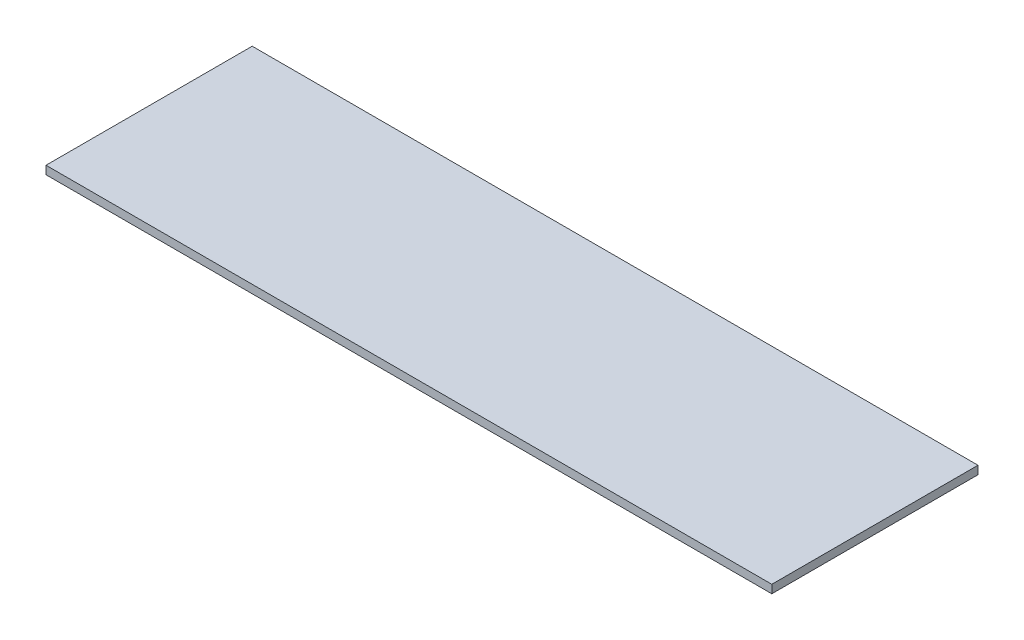
from build123d import *

# Parameters (mm, degrees)
SKETCH1_W           = 176
SKETCH1_H           = 50
BOSS_EXTRUDE1_DEPTH = 2


with BuildPart() as part:
    # Sketch1 → Boss-Extrude1 (new body)
    with BuildSketch(Plane(origin=(0, 0, 0), x_dir=(1, 0, 0), z_dir=(0, 1, 0))):
        Rectangle(SKETCH1_W, SKETCH1_H)
    extrude(amount=BOSS_EXTRUDE1_DEPTH)


solid = part.part
